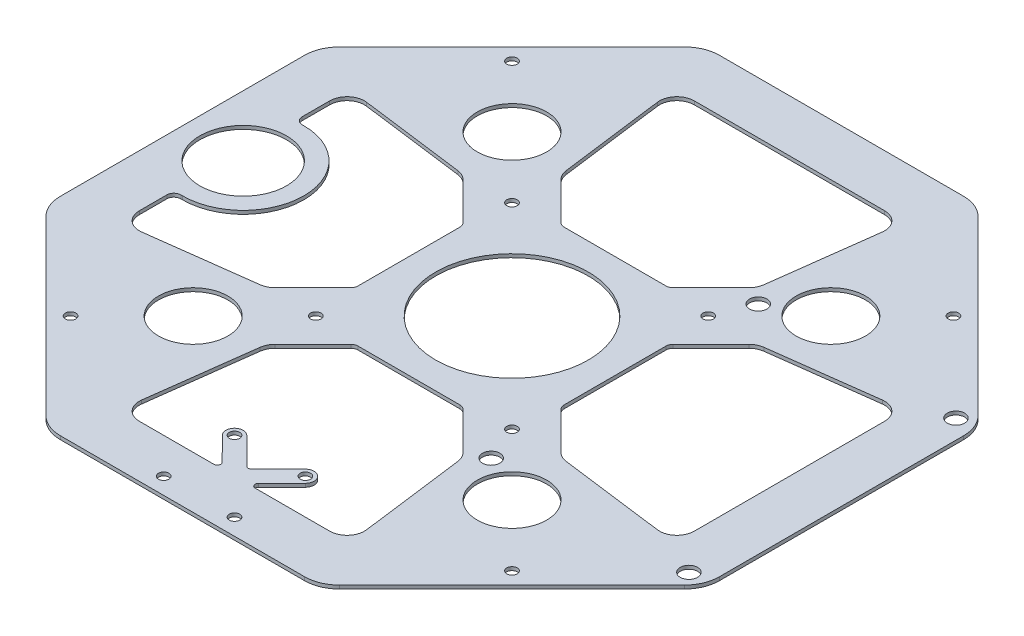
from build123d import *

# Parameters (mm, degrees)
SKETCH1_R           = 1.5
SKETCH1_R_2         = 10
SKETCH1_R_3         = 22
SKETCH1_R_4         = 2.5
SKETCH1_R_5         = 12.5
BOSS_EXTRUDE1_DEPTH = 1


with BuildPart() as part:
    # Sketch1 → Boss-Extrude1 (new body)
    with BuildSketch(Plane(origin=(0, 0, 0), x_dir=(1, 0, 0), z_dir=(0, 1, 0))):
        with BuildLine():
            Line((92.071067812, 42.279220614), (42.279220614, 92.071067812))
            ThreePointArc((42.279220614, 92.071067812), (39.034987125, 94.238795325), (35.208152802, 95))
            Line((35.208152802, 95), (-35.208152802, 95))
            ThreePointArc((-35.208152802, 95), (-39.034987125, 94.238795325), (-42.279220614, 92.071067812))
            Line((-42.279220614, 92.071067812), (-92.071067812, 42.279220614))
            ThreePointArc((-92.071067812, 42.279220614), (-94.238795325, 39.034987125), (-95, 35.208152802))
            Line((-95, 35.208152802), (-95, -35.208152802))
            ThreePointArc((-95, -35.208152802), (-94.238795325, -39.034987125), (-92.071067812, -42.279220614))
            Line((-92.071067812, -42.279220614), (-42.279220614, -92.071067812))
            ThreePointArc((-42.279220614, -92.071067812), (-39.034987125, -94.238795325), (-35.208152802, -95))
            Line((-35.208152802, -95), (35.208152802, -95))
            ThreePointArc((35.208152802, -95), (39.034987125, -94.238795325), (42.279220614, -92.071067812))
            Line((42.279220614, -92.071067812), (92.071067812, -42.279220614))
            ThreePointArc((92.071067812, -42.279220614), (94.238795325, -39.034987125), (95, -35.208152802))
            Line((95, -35.208152802), (95, 35.208152802))
            ThreePointArc((95, 35.208152802), (94.238795325, 39.034987125), (92.071067812, 42.279220614))
        make_face()
        with Locations(Location((63.639610307, 63.639610307, 0), (0, 0, 270))):
            Circle(SKETCH1_R, mode=Mode.SUBTRACT)
        with Locations(Location((28.284271247, 28.284271247, 0), (0, 0, 270))):
            Circle(SKETCH1_R, mode=Mode.SUBTRACT)
        with Locations(Location((63.639610307, -63.639610307, 0), (0, 0, 270))):
            Circle(SKETCH1_R, mode=Mode.SUBTRACT)
        with Locations(Location((28.284271247, -28.284271247, 0), (0, 0, 270))):
            Circle(SKETCH1_R, mode=Mode.SUBTRACT)
        with Locations(Location((-63.639610307, -63.639610307, 0), (0, 0, 270))):
            Circle(SKETCH1_R, mode=Mode.SUBTRACT)
        with Locations(Location((-28.284271247, -28.284271247, 0), (0, 0, 270))):
            Circle(SKETCH1_R, mode=Mode.SUBTRACT)
        with Locations(Location((-63.639610307, 63.639610307, 0), (0, 0, 270))):
            Circle(SKETCH1_R, mode=Mode.SUBTRACT)
        with Locations(Location((-28.284271247, 28.284271247, 0), (0, 0, 270))):
            Circle(SKETCH1_R, mode=Mode.SUBTRACT)
        with Locations(Location((45.961940777, 45.961940777, 0), (0, 0, 270))):
            Circle(SKETCH1_R_2, mode=Mode.SUBTRACT)
        with Locations(Location((45.961940777, -45.961940777, 0), (0, 0, 270))):
            Circle(SKETCH1_R_2, mode=Mode.SUBTRACT)
        with Locations(Location((-45.961940777, -45.961940777, 0), (0, 0, 270))):
            Circle(SKETCH1_R_2, mode=Mode.SUBTRACT)
        with Locations(Location((0, 0, 0), (0, 0, 270))):
            Circle(SKETCH1_R_3, mode=Mode.SUBTRACT)
        with Locations(Location((32.5, 38.5, 0), (0, 0, 270))):
            Circle(SKETCH1_R_4, mode=Mode.SUBTRACT)
        with Locations(Location((89.5, 38.5, 0), (0, 0, 270))):
            Circle(SKETCH1_R_4, mode=Mode.SUBTRACT)
        with Locations(Location((32.5, -38.5, 0), (0, 0, 270))):
            Circle(SKETCH1_R_4, mode=Mode.SUBTRACT)
        with Locations(Location((89.5, -38.5, 0), (0, 0, 270))):
            Circle(SKETCH1_R_4, mode=Mode.SUBTRACT)
        with Locations(Location((-77.5, 0, 0), (0, 0, 270))):
            Circle(SKETCH1_R_5, mode=Mode.SUBTRACT)
        with Locations(Location((-45.961940777, 45.961940777, 0), (0, 0, 270))):
            Circle(SKETCH1_R_2, mode=Mode.SUBTRACT)
        with Locations(Location((-10.213834715, -90.213834715, 0), (0, 0, 270))):
            Circle(SKETCH1_R, mode=Mode.SUBTRACT)
        with Locations(Location((10.213834715, -69.786165285, 0), (0, 0, 270))):
            Circle(SKETCH1_R, mode=Mode.SUBTRACT)
        with Locations(Location((10.213834715, -90.213834715, 0), (0, 0, 270))):
            Circle(SKETCH1_R, mode=Mode.SUBTRACT)
        with Locations(Location((-10.213834715, -69.786165285, 0), (0, 0, 90))):
            Circle(SKETCH1_R, mode=Mode.SUBTRACT)
        with BuildLine():
            Line((27.079275596, 41.221411219), (16.142135624, 30.284271247))
            ThreePointArc((16.142135624, 30.284271247), (15.493288926, 29.850725745), (14.727922061, 29.69848481))
            Line((14.727922061, 29.69848481), (-14.727922061, 29.69848481))
            ThreePointArc((-14.727922061, 29.69848481), (-15.493288926, 29.850725745), (-16.142135624, 30.284271247))
            Line((-16.142135624, 30.284271247), (-27.079275596, 41.221411219))
            ThreePointArc((-27.079275596, 41.221411219), (-28.030817483, 42.551009763), (-28.502553799, 44.116490233))
            Line((-28.502553799, 44.116490233), (-32.40859259, 74.359545108))
            ThreePointArc((-32.40859259, 74.359545108), (-31.204928579, 78.301342571), (-27.449780482, 80))
            Line((-27.449780482, 80), (27.449780482, 80))
            ThreePointArc((27.449780482, 80), (31.204928579, 78.301342571), (32.40859259, 74.359545108))
            Line((32.40859259, 74.359545108), (28.502553799, 44.116490233))
            ThreePointArc((28.502553799, 44.116490233), (28.030817483, 42.551009763), (27.079275596, 41.221411219))
        make_face(mode=Mode.SUBTRACT)
        with BuildLine():
            Line((30.284271247, 16.142135624), (41.221411219, 27.079275596))
            ThreePointArc((41.221411219, 27.079275596), (42.551009763, 28.030817483), (44.116490233, 28.502553799))
            Line((44.116490233, 28.502553799), (74.359545108, 32.40859259))
            ThreePointArc((74.359545108, 32.40859259), (78.301342571, 31.204928579), (80, 27.449780482))
            Line((80, 27.449780482), (80, -27.449780482))
            ThreePointArc((80, -27.449780482), (78.301342571, -31.204928579), (74.359545108, -32.40859259))
            Line((74.359545108, -32.40859259), (44.116490233, -28.502553799))
            ThreePointArc((44.116490233, -28.502553799), (42.551009763, -28.030817483), (41.221411219, -27.079275596))
            Line((41.221411219, -27.079275596), (30.284271247, -16.142135624))
            ThreePointArc((30.284271247, -16.142135624), (29.850725745, -15.493288926), (29.69848481, -14.727922061))
            Line((29.69848481, -14.727922061), (29.69848481, 14.727922061))
            ThreePointArc((29.69848481, 14.727922061), (29.850725745, 15.493288926), (30.284271247, 16.142135624))
        make_face(mode=Mode.SUBTRACT)
        with BuildLine():
            Line((16.142135624, -30.284271247), (27.079275596, -41.221411219))
            ThreePointArc((27.079275596, -41.221411219), (28.030817483, -42.551009763), (28.502553799, -44.116490233))
            Line((28.502553799, -44.116490233), (32.40859259, -74.359545108))
            ThreePointArc((32.40859259, -74.359545108), (31.204928579, -78.301342571), (27.449780482, -80))
            Line((27.449780482, -80), (5.951214226, -80))
            ThreePointArc((5.951214226, -80), (5.027355519, -79.382733708), (5.24403049, -78.292970182))
            Line((5.24403049, -78.292970182), (6.875240199, -76.661405364))
            Line((6.875240199, -76.661405364), (11.981794054, -71.553739831))
            ThreePointArc((11.981794054, -71.553739831), (11.98140926, -68.018205946), (8.445875375, -68.01859074))
            Line((8.445875375, -68.01859074), (3.339706293, -73.125871458))
            Line((3.339706293, -73.125871458), (0.707183739, -75.758967125))
            ThreePointArc((0.707183739, -75.758967125), (0, -76.05193731), (-0.707183739, -75.758967125))
            Line((-0.707183739, -75.758967125), (-3.339706293, -73.125871458))
            Line((-3.339706293, -73.125871458), (-8.445875375, -68.01859074))
            ThreePointArc((-8.445875375, -68.01859074), (-11.98140926, -68.018205946), (-11.981794054, -71.553739831))
            Line((-11.981794054, -71.553739831), (-6.875240199, -76.661405364))
            Line((-6.875240199, -76.661405364), (-5.24403049, -78.292970182))
            ThreePointArc((-5.24403049, -78.292970182), (-5.027355519, -79.382733708), (-5.951214226, -80))
            Line((-5.951214226, -80), (-27.449780482, -80))
            ThreePointArc((-27.449780482, -80), (-31.204928579, -78.301342571), (-32.40859259, -74.359545108))
            Line((-32.40859259, -74.359545108), (-28.502553799, -44.116490233))
            ThreePointArc((-28.502553799, -44.116490233), (-28.030817483, -42.551009763), (-27.079275596, -41.221411219))
            Line((-27.079275596, -41.221411219), (-16.142135624, -30.284271247))
            ThreePointArc((-16.142135624, -30.284271247), (-15.493288926, -29.850725745), (-14.727922061, -29.69848481))
            Line((-14.727922061, -29.69848481), (14.727922061, -29.69848481))
            ThreePointArc((14.727922061, -29.69848481), (15.493288926, -29.850725745), (16.142135624, -30.284271247))
        make_face(mode=Mode.SUBTRACT)
        with BuildLine():
            Line((-30.284271247, -16.142135624), (-41.221411219, -27.079275596))
            ThreePointArc((-41.221411219, -27.079275596), (-42.551009763, -28.030817483), (-44.116490233, -28.502553799))
            Line((-44.116490233, -28.502553799), (-74.359545108, -32.40859259))
            ThreePointArc((-74.359545108, -32.40859259), (-78.301342571, -31.204928579), (-80, -27.449780482))
            Line((-80, -27.449780482), (-80, -19.5))
            ThreePointArc((-80, -19.5), (-79.414213562, -18.085786438), (-78, -17.5))
            Line((-78, -17.5), (-77.5, -17.5))
            ThreePointArc((-77.5, -17.5), (-60, 0), (-77.5, 17.5))
            Line((-77.5, 17.5), (-78, 17.5))
            ThreePointArc((-78, 17.5), (-79.414213562, 18.085786438), (-80, 19.5))
            Line((-80, 19.5), (-80, 27.449780482))
            ThreePointArc((-80, 27.449780482), (-78.301342571, 31.204928579), (-74.359545108, 32.40859259))
            Line((-74.359545108, 32.40859259), (-44.116490233, 28.502553799))
            ThreePointArc((-44.116490233, 28.502553799), (-42.551009763, 28.030817483), (-41.221411219, 27.079275596))
            Line((-41.221411219, 27.079275596), (-30.284271247, 16.142135624))
            ThreePointArc((-30.284271247, 16.142135624), (-29.850725745, 15.493288926), (-29.69848481, 14.727922061))
            Line((-29.69848481, 14.727922061), (-29.69848481, -14.727922061))
            ThreePointArc((-29.69848481, -14.727922061), (-29.850725745, -15.493288926), (-30.284271247, -16.142135624))
        make_face(mode=Mode.SUBTRACT)
    extrude(amount=BOSS_EXTRUDE1_DEPTH)


solid = part.part
